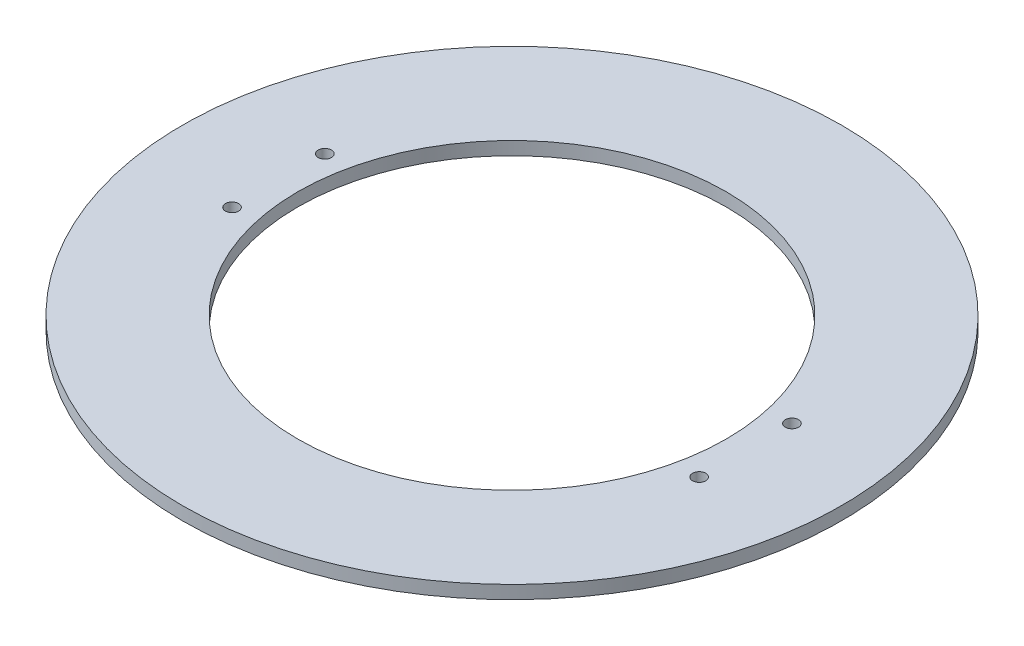
from build123d import *

# Parameters (mm, degrees)
SKETCH2_R           = 100
SKETCH2_R_2         = 65
SKETCH2_R_3         = 2
BOSS_EXTRUDE1_DEPTH = 4


with BuildPart() as part:
    # Sketch2 → Boss-Extrude1 (new body)
    with BuildSketch(Plane(origin=(0, 0, 0), x_dir=(1, 0, 0), z_dir=(0, 1, 0))):
        with Locations(Location((0, 0, 0), (0, 0, 270))):
            Circle(SKETCH2_R)
        with Locations(Location((0, 0, 0), (0, 0, 270))):
            Circle(SKETCH2_R_2, mode=Mode.SUBTRACT)
        with Locations(Location((-70.87, 14.075, 0), (0, 0, 270))):
            Circle(SKETCH2_R_3, mode=Mode.SUBTRACT)
        with Locations(Location((-70.87, -14.075, 0), (0, 0, 90))):
            Circle(SKETCH2_R_3, mode=Mode.SUBTRACT)
        with Locations(Location((70.87, -14.075, 0), (0, 0, 270))):
            Circle(SKETCH2_R_3, mode=Mode.SUBTRACT)
        with Locations(Location((70.87, 14.075, 0), (0, 0, 90))):
            Circle(SKETCH2_R_3, mode=Mode.SUBTRACT)
    extrude(amount=BOSS_EXTRUDE1_DEPTH)


solid = part.part
